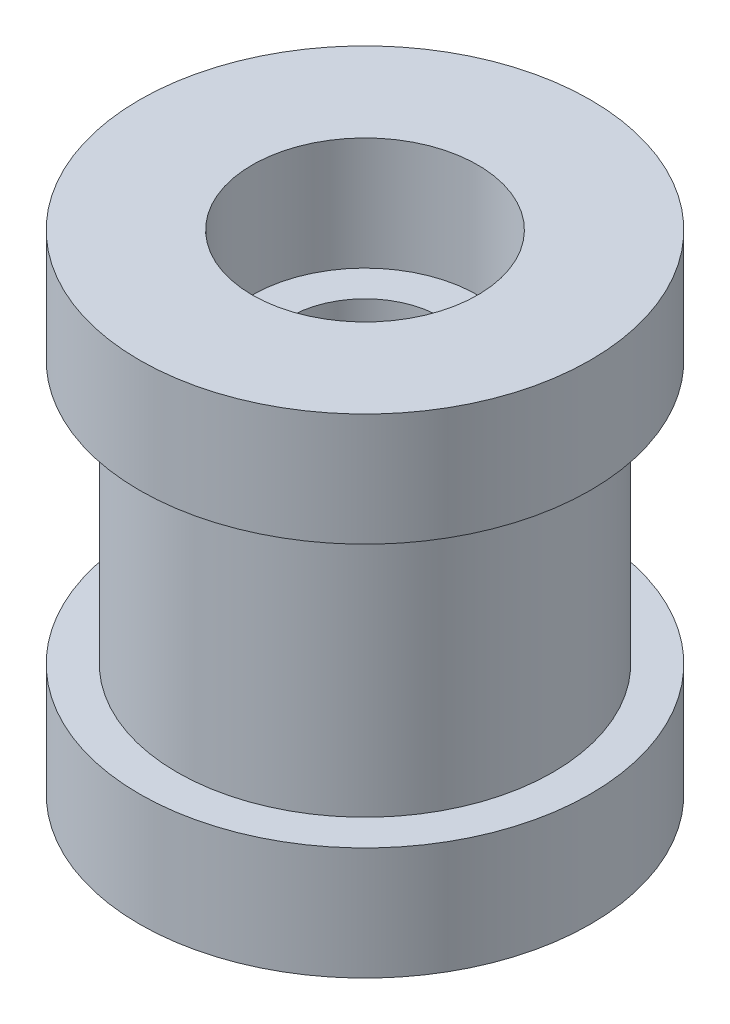
from build123d import *


with BuildPart() as part:
    # Croquis1 → Revolución2 (revolve)
    with BuildSketch(Plane.XY, mode=Mode.PRIVATE) as revoluci_n2_sk:
        Polygon((-45, 36.484111652), (-30, 36.484111652), (-30, 6.484111652), (-20, 6.484111652), (-20, -8.515888348), (-27.5, -8.515888348), (-35, -8.515888348), (-35, -48.515888348), (-20, -48.515888348), (-20, -63.515888348), (-30, -63.515888348), (-30, -93.515888348), (-60, -93.515888348), (-60, -63.515888348), (-50, -63.515888348), (-50, 6.484111652), (-60, 6.484111652), (-60, 36.484111652), align=None)
    revolve(revoluci_n2_sk.sketch.rotate(Axis((0, 96.458371867, 0), (0, -1, 0)), 270), axis=Axis((0, 96.458371867, 0), (0, -1, 0)))


solid = part.part
